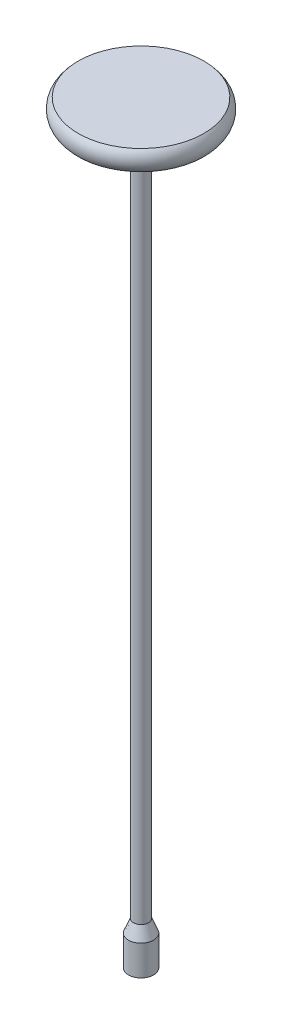
from build123d import *


with BuildPart() as part:
    # Sketch1 → Revolve2 (revolve)
    with BuildSketch(Plane.XY, mode=Mode.PRIVATE) as revolve2_sk:
        with BuildLine():
            Line((-5, 327.232699925), (-5, 317.232699925))
            add(Edge.make_bspline(
                [(-5, 317.232699925), (-3.994069006, 317.33794331), (-3, 317.520687178)],
                knots=[0, 0, 0, 1, 1, 1], degree=2))
            Line((-3, 317.520687178), (-3, 52.232699925))
            Line((-3, 52.232699925), (-5, 47.232699925))
            Line((-5, 47.232699925), (-5, 35.232699925))
            Line((-5, 35.232699925), (-4, 35.232699925))
            Line((-4, 35.232699925), (-4, 46.232699925))
            Line((-4, 46.232699925), (0, 46.232699925))
            Line((0, 46.232699925), (0, 335.232699925))
            Line((0, 335.232699925), (-25, 335.232699925))
            ThreePointArc((-25, 335.232699925), (-26.656854249, 331.232699925), (-25, 327.232699925))
            Line((-25, 327.232699925), (-5, 327.232699925))
        make_face()
    revolve(revolve2_sk.sketch.rotate(Axis((0, 0, 0), (0, 1, 0)), 270), axis=Axis((0, 0, 0), (0, 1, 0)))


solid = part.part
